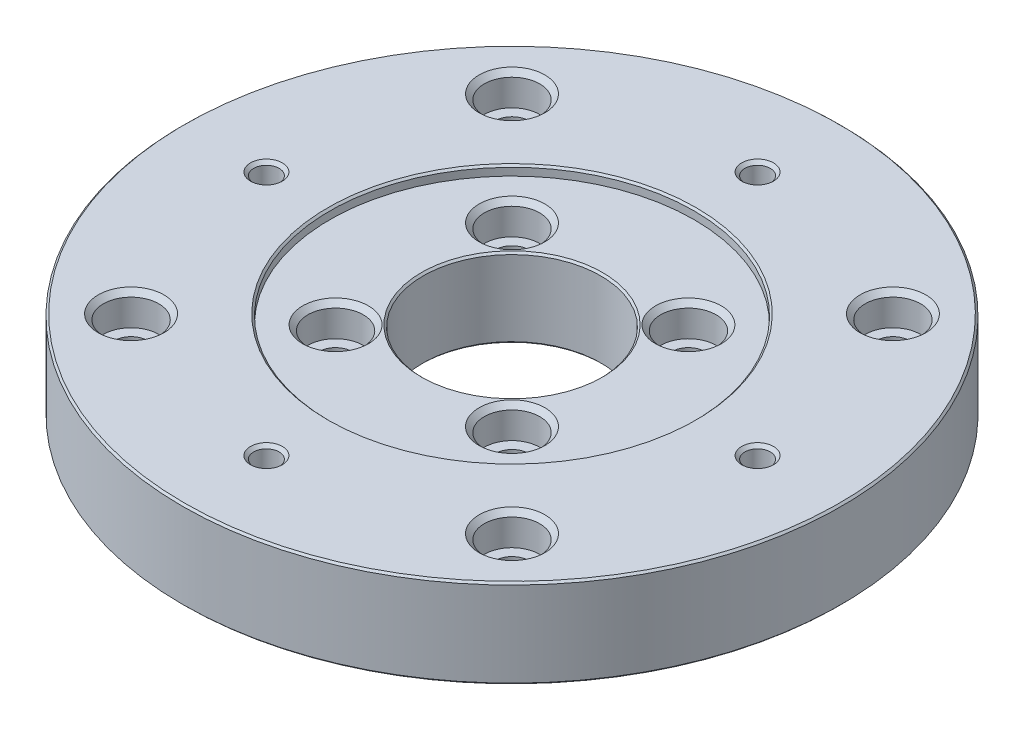
from build123d import *

# Parameters (mm, degrees)
SKETCH1_R                                     = 66.04
BOSS_EXTRUDE1_DEPTH                           = 17.78
SKETCH2_R                                     = 36.4998
CUT_EXTRUDE1_DEPTH                            = 1.905
CUT_EXTRUDE2_DEPTH                            = 95.734253705
CUT_EXTRUDE2_DEPTH_BACK                       = 19.05
SKETCH3_R                                     = 17.78
F_1_4_20_TAPPED_HOLE1_AT_2_COUNT              = 2
F_1_4_20_TAPPED_HOLE1_AT_2_PITCH              = 69.596984938
F_1_4_20_TAPPED_HOLE1_AT_3_COUNT              = 2
F_1_4_20_TAPPED_HOLE1_AT_3_PITCH              = 98.425
F_1_4_20_TAPPED_HOLE1_AT_4_COUNT              = 2
F_1_4_20_TAPPED_HOLE1_AT_4_PITCH              = 69.596984938
CBORE_FOR_1_4_SOCKET_HEAD_CAP_SCREW1_AT_COUNT = 2
CBORE_FOR_1_4_SOCKET_HEAD_CAP_SCREW1_AT_PITCH = 25
CBORE_FOR_1_4_SOCKET_HEAD_CAP_SCREW1_2_COUNT  = 2
CBORE_FOR_1_4_SOCKET_HEAD_CAP_SCREW1_2_PITCH  = 25
CBORE_FOR_1_4_SOCKET_HEAD_CAP_SCREW1_3_COUNT  = 2
CBORE_FOR_1_4_SOCKET_HEAD_CAP_SCREW1_3_PITCH  = 25
CBORE_FOR_1_4_SOCKET_HEAD_CAP_SCREW1_4_COUNT  = 2
CBORE_FOR_1_4_SOCKET_HEAD_CAP_SCREW1_4_PITCH  = 25
CHAMFER1_SIZE                                 = 0.381
CBORE_FOR_1_4_SOCKET_HEAD_CAP_SCREW2_AT_COUNT = 2
CBORE_FOR_1_4_SOCKET_HEAD_CAP_SCREW2_AT_PITCH = 53.975
CBORE_FOR_1_4_SOCKET_HEAD_CAP_SCREW2_2_COUNT  = 2
CBORE_FOR_1_4_SOCKET_HEAD_CAP_SCREW2_2_PITCH  = 53.975
CBORE_FOR_1_4_SOCKET_HEAD_CAP_SCREW2_3_COUNT  = 2
CBORE_FOR_1_4_SOCKET_HEAD_CAP_SCREW2_3_PITCH  = 53.975
CBORE_FOR_1_4_SOCKET_HEAD_CAP_SCREW2_4_COUNT  = 2
CBORE_FOR_1_4_SOCKET_HEAD_CAP_SCREW2_4_PITCH  = 53.975


with BuildPart() as part:
    # Sketch1 → Boss-Extrude1 (new body)
    with BuildSketch(Plane(origin=(0, 0, 0), x_dir=(1, 0, 0), z_dir=(0, 1, 0))):
        with Locations(Location((0, 0, 0), (0, 0, 270))):
            Circle(SKETCH1_R)
    extrude(amount=BOSS_EXTRUDE1_DEPTH)

    # Sketch2 → Cut-Extrude1 (cut)
    with BuildSketch(Plane(origin=(0, 17.78, 0), x_dir=(1, 0, 0), z_dir=(0, 1, 0))):
        with Locations(Location((0, 0, 0), (0, 0, 270))):
            Circle(SKETCH2_R)
    extrude(amount=-CUT_EXTRUDE1_DEPTH, mode=Mode.SUBTRACT)

    # Sketch3 → Cut-Extrude2 (cut, two sides: drawn at the far end of the back side and taken through both)
    with BuildSketch(Plane(origin=(0, 15.875, 0), x_dir=(1, 0, 0), z_dir=(0, 1, 0)).offset(-CUT_EXTRUDE2_DEPTH_BACK)):
        with Locations(Location((0, 0, 0), (0, 0, 270))):
            Circle(SKETCH3_R)
    extrude(amount=CUT_EXTRUDE2_DEPTH + CUT_EXTRUDE2_DEPTH_BACK, mode=Mode.SUBTRACT)

    # Sketch5 → 1/4-20 Tapped Hole1 (revolve, cut)
    with BuildSketch(Plane(origin=(0, 17.78, -49.2125), x_dir=(0, 0, 1), z_dir=(1, 0, 0))):
        Polygon((0, 0), (0, 17.78), (3.1877, 17.78), (2.5527, 17.145), (2.5527, 0.635), (3.1877, 0), align=None)
    f_1_4_20_tapped_hole1 = revolve(axis=Axis((0, 24.13, -49.2125), (0, -1, 0)), mode=Mode.SUBTRACT)

    # 1/4-20 Tapped Hole1 at 2: 1/4-20 Tapped Hole1 ×2
    with Locations(*[Vector(0.7071067811865476, 0, 0.7071067811865476) * (i * F_1_4_20_TAPPED_HOLE1_AT_2_PITCH) for i in range(1, F_1_4_20_TAPPED_HOLE1_AT_2_COUNT)]):
        add(f_1_4_20_tapped_hole1, mode=Mode.SUBTRACT)

    # 1/4-20 Tapped Hole1 at 3: 1/4-20 Tapped Hole1 ×2
    with Locations(*[(0, 0, i * F_1_4_20_TAPPED_HOLE1_AT_3_PITCH) for i in range(1, F_1_4_20_TAPPED_HOLE1_AT_3_COUNT)]):
        add(f_1_4_20_tapped_hole1, mode=Mode.SUBTRACT)

    # 1/4-20 Tapped Hole1 at 4: 1/4-20 Tapped Hole1 ×2
    with Locations(*[Vector(-0.7071067811865476, 0, 0.7071067811865476) * (i * F_1_4_20_TAPPED_HOLE1_AT_4_PITCH) for i in range(1, F_1_4_20_TAPPED_HOLE1_AT_4_COUNT)]):
        add(f_1_4_20_tapped_hole1, mode=Mode.SUBTRACT)

    # Sketch7 → CBORE for 1/4 Socket Head Cap Screw1 (revolve, cut)
    with BuildSketch(Plane(origin=(0, 15.875, 0), x_dir=(0, 0, 1), z_dir=(1, 0, 0))):
        Polygon((0, 0), (0, 15.875), (4.0132, 15.875), (3.3782, 15.24), (3.3782, 6.35), (5.55625, 6.35), (5.55625, 1.03251), (6.58876, 0), align=None)
    cbore_for_1_4_socket_head_cap_screw1 = revolve(axis=Axis((0, 22.225, 0), (0, -1, 0)), mode=Mode.SUBTRACT)

    # CBORE for 1/4 Socket Head Cap Screw1 at: CBORE for 1/4 Socket Head Cap Screw1 ×2
    with Locations(*[Vector(0.7071067811865476, 0, -0.7071067811865476) * (i * CBORE_FOR_1_4_SOCKET_HEAD_CAP_SCREW1_AT_PITCH) for i in range(1, CBORE_FOR_1_4_SOCKET_HEAD_CAP_SCREW1_AT_COUNT)]):
        add(cbore_for_1_4_socket_head_cap_screw1, mode=Mode.SUBTRACT)

    # CBORE for 1_4 Socket Head Cap Screw1 2: CBORE for 1/4 Socket Head Cap Screw1 ×2
    with Locations(*[Vector(-0.7071067811865476, 0, 0.7071067811865476) * (i * CBORE_FOR_1_4_SOCKET_HEAD_CAP_SCREW1_2_PITCH) for i in range(1, CBORE_FOR_1_4_SOCKET_HEAD_CAP_SCREW1_2_COUNT)]):
        add(cbore_for_1_4_socket_head_cap_screw1, mode=Mode.SUBTRACT)

    # CBORE for 1_4 Socket Head Cap Screw1 3: CBORE for 1/4 Socket Head Cap Screw1 ×2
    with Locations(*[Vector(-0.7071067811865475, 0, -0.7071067811865477) * (i * CBORE_FOR_1_4_SOCKET_HEAD_CAP_SCREW1_3_PITCH) for i in range(1, CBORE_FOR_1_4_SOCKET_HEAD_CAP_SCREW1_3_COUNT)]):
        add(cbore_for_1_4_socket_head_cap_screw1, mode=Mode.SUBTRACT)

    # CBORE for 1_4 Socket Head Cap Screw1 4: CBORE for 1/4 Socket Head Cap Screw1 ×2
    with Locations(*[Vector(0.7071067811865477, 0, 0.7071067811865475) * (i * CBORE_FOR_1_4_SOCKET_HEAD_CAP_SCREW1_4_PITCH) for i in range(1, CBORE_FOR_1_4_SOCKET_HEAD_CAP_SCREW1_4_COUNT)]):
        add(cbore_for_1_4_socket_head_cap_screw1, mode=Mode.SUBTRACT)

    # Chamfer1
    chamfer1_edges = [part.edges().sort_by_distance(p)[0] for p in [
        (0, 15.875, -17.78),
        (0, 0, -17.78),
        (0, 0, -66.04),
        (0, 17.78, -66.04),
        (0, 17.78, -36.4998),
    ]]
    chamfer(chamfer1_edges, length=CHAMFER1_SIZE)

    # Sketch9 → CBORE for 1/4 Socket Head Cap Screw2 (revolve, cut)
    with BuildSketch(Plane(origin=(0, 17.78, 0), x_dir=(0, 0, 1), z_dir=(1, 0, 0))):
        Polygon((0, 0), (0, 17.78), (4.0132, 17.78), (3.3782, 17.145), (3.3782, 6.35), (5.55625, 6.35), (5.55625, 1.03251), (6.58876, 0), align=None)
    cbore_for_1_4_socket_head_cap_screw2 = revolve(axis=Axis((0, 24.13, 0), (0, -1, 0)), mode=Mode.SUBTRACT)

    # CBORE for 1/4 Socket Head Cap Screw2 at: CBORE for 1/4 Socket Head Cap Screw2 ×2
    with Locations(*[Vector(0.7071067811865476, 0, 0.7071067811865475) * (i * CBORE_FOR_1_4_SOCKET_HEAD_CAP_SCREW2_AT_PITCH) for i in range(1, CBORE_FOR_1_4_SOCKET_HEAD_CAP_SCREW2_AT_COUNT)]):
        add(cbore_for_1_4_socket_head_cap_screw2, mode=Mode.SUBTRACT)

    # CBORE for 1_4 Socket Head Cap Screw2 2: CBORE for 1/4 Socket Head Cap Screw2 ×2
    with Locations(*[Vector(-0.7071067811865476, 0, -0.7071067811865476) * (i * CBORE_FOR_1_4_SOCKET_HEAD_CAP_SCREW2_2_PITCH) for i in range(1, CBORE_FOR_1_4_SOCKET_HEAD_CAP_SCREW2_2_COUNT)]):
        add(cbore_for_1_4_socket_head_cap_screw2, mode=Mode.SUBTRACT)

    # CBORE for 1_4 Socket Head Cap Screw2 3: CBORE for 1/4 Socket Head Cap Screw2 ×2
    with Locations(*[Vector(-0.7071067811865477, 0, 0.7071067811865475) * (i * CBORE_FOR_1_4_SOCKET_HEAD_CAP_SCREW2_3_PITCH) for i in range(1, CBORE_FOR_1_4_SOCKET_HEAD_CAP_SCREW2_3_COUNT)]):
        add(cbore_for_1_4_socket_head_cap_screw2, mode=Mode.SUBTRACT)

    # CBORE for 1_4 Socket Head Cap Screw2 4: CBORE for 1/4 Socket Head Cap Screw2 ×2
    with Locations(*[Vector(0.7071067811865475, 0, -0.7071067811865477) * (i * CBORE_FOR_1_4_SOCKET_HEAD_CAP_SCREW2_4_PITCH) for i in range(1, CBORE_FOR_1_4_SOCKET_HEAD_CAP_SCREW2_4_COUNT)]):
        add(cbore_for_1_4_socket_head_cap_screw2, mode=Mode.SUBTRACT)


solid = part.part
